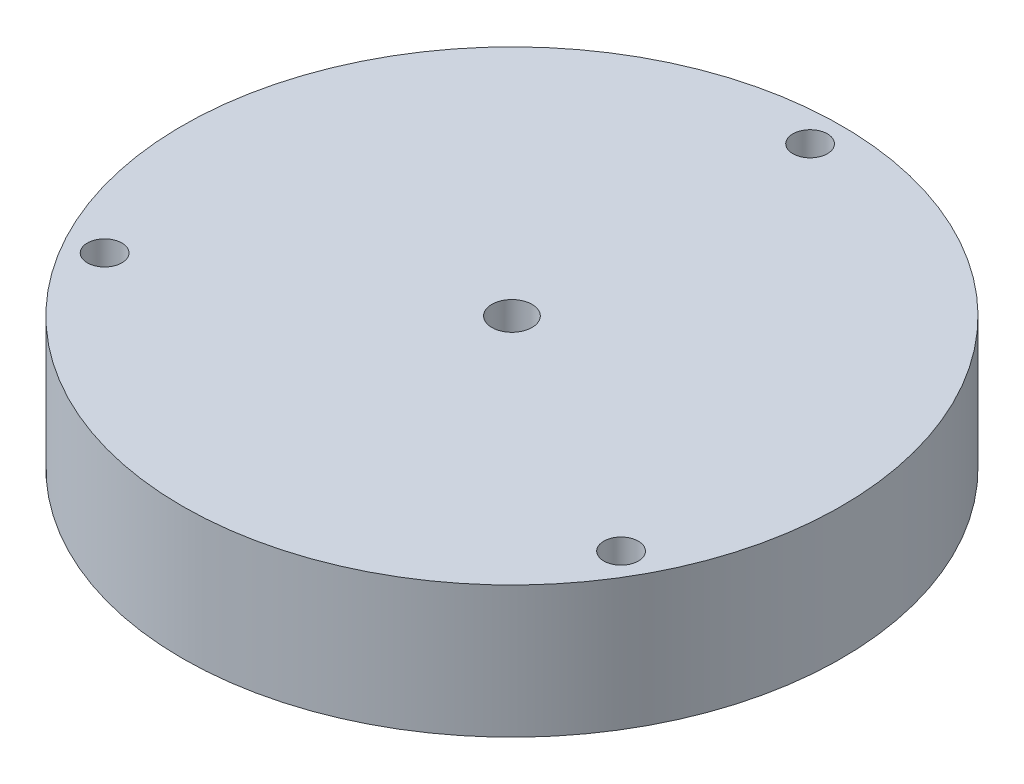
from build123d import *

# Parameters (mm, degrees)
ESQUISSE1_R             = 52.5
BOSS_EXTRU_1_DEPTH      = 18
ESQUISSE2_R             = 52.5
BOSS_EXTRU_2_DEPTH      = 3
ENL_V_START             = -3
ESQUISSE3_R             = 2.75
ENL_V_MAT_EXTRU_2_DEPTH = 75.158926898
ESQUISSE4_R             = 1.55
ENL_V_MAT_EXTRU_3_DEPTH = 78.158926898
ESQUISSE6_R             = 6
BOSS_EXTRU_3_DEPTH      = 10
ESQUISSE7_R             = 3.2
ENL_V_MAT_EXTRU_5_DEPTH = 78.158926898


with BuildPart() as part:
    # Esquisse1 → Boss.-Extru.1 (new body)
    with BuildSketch(Plane(origin=(0, 0, 0), x_dir=(1, 0, 0), z_dir=(0, 1, 0))):
        with Locations(Location((0, 0, 0), (0, 0, 270))):
            Circle(ESQUISSE1_R)
        with BuildLine():
            ThreePointArc((-4, 47.5), (0, 43.5), (4, 47.5))
            Line((4, 47.5), (4, 48.127435003))
            ThreePointArc((4, 48.127435003), (4.676150568, 49.626575651), (6.24742268, 50.112071498))
            ThreePointArc((6.24742268, 50.112071498), (43.734282891, 25.25), (46.522038294, -19.645609))
            ThreePointArc((46.522038294, -19.645609), (45.3159505, -20.763622642), (43.679581332, -20.599615887))
            Line((43.679581332, -20.599615887), (43.13620668, -20.285898385))
            ThreePointArc((43.13620668, -20.285898385), (37.672105065, -21.75), (39.13620668, -27.214101615))
            Line((39.13620668, -27.214101615), (39.679581332, -27.527819117))
            ThreePointArc((39.679581332, -27.527819117), (40.639799932, -28.862953009), (40.274615614, -30.466462499))
            ThreePointArc((40.274615614, -30.466462499), (0, -50.5), (-40.274615614, -30.466462499))
            ThreePointArc((-40.274615614, -30.466462499), (-40.639799932, -28.862953009), (-39.679581332, -27.527819117))
            Line((-39.679581332, -27.527819117), (-39.13620668, -27.214101615))
            ThreePointArc((-39.13620668, -27.214101615), (-37.672105065, -21.75), (-43.13620668, -20.285898385))
            Line((-43.13620668, -20.285898385), (-43.679581332, -20.599615887))
            ThreePointArc((-43.679581332, -20.599615887), (-45.3159505, -20.763622642), (-46.522038294, -19.645609))
            ThreePointArc((-46.522038294, -19.645609), (-43.734282891, 25.25), (-6.24742268, 50.112071498))
            ThreePointArc((-6.24742268, 50.112071498), (-4.676150568, 49.626575651), (-4, 48.127435003))
            Line((-4, 48.127435003), (-4, 47.5))
        make_face(mode=Mode.SUBTRACT)
    extrude(amount=BOSS_EXTRU_1_DEPTH)

    # Esquisse2 → Boss.-Extru.2 (add)
    with BuildSketch(Plane(origin=(0, 18, 0), x_dir=(1, 0, 0), z_dir=(0, 1, 0))):
        with Locations(Location((0, 0, 0), (0, 0, 270))):
            Circle(ESQUISSE2_R)
    extrude(amount=BOSS_EXTRU_2_DEPTH)

    # Esquisse3 → Enlèv. mat.-Extru.2 (cut, through all)
    with BuildSketch(Plane.XZ.offset(ENL_V_START)):
        with Locations(Location((0, -47.5, 0), (0, 0, 270))):
            Circle(ESQUISSE3_R)
        with Locations(Location((-41.13620668, 23.75, 0), (0, 0, 270))):
            Circle(ESQUISSE3_R)
        with Locations(Location((41.13620668, 23.75, 0), (0, 0, 270))):
            Circle(ESQUISSE3_R)
    extrude(amount=-ENL_V_MAT_EXTRU_2_DEPTH, mode=Mode.SUBTRACT)

    # Esquisse4 → Enlèv. mat.-Extru.3 (cut, through all)
    with BuildSketch(Plane.XZ):
        with Locations(Location((0, -47.5, 0), (0, 0, 270))):
            Circle(ESQUISSE4_R)
        with Locations(Location((-41.13620668, 23.75, 0), (0, 0, 270))):
            Circle(ESQUISSE4_R)
        with Locations(Location((41.13620668, 23.75, 0), (0, 0, 270))):
            Circle(ESQUISSE4_R)
    extrude(amount=-ENL_V_MAT_EXTRU_3_DEPTH, mode=Mode.SUBTRACT)

    # Esquisse6 → Boss.-Extru.3 (add)
    with BuildSketch(Plane.XZ.offset(-18)):
        with Locations(Location((0, 0, 0), (0, 0, 90))):
            Circle(ESQUISSE6_R)
    extrude(amount=BOSS_EXTRU_3_DEPTH)

    # Esquisse7 → Enlèv. mat.-Extru.5 (cut, through all)
    with BuildSketch(Plane(origin=(0, 21, 0), x_dir=(1, 0, 0), z_dir=(0, 1, 0))):
        with Locations(Location((0, 0, 0), (0, 0, 270))):
            Circle(ESQUISSE7_R)
    extrude(amount=-ENL_V_MAT_EXTRU_5_DEPTH, mode=Mode.SUBTRACT)


solid = part.part
